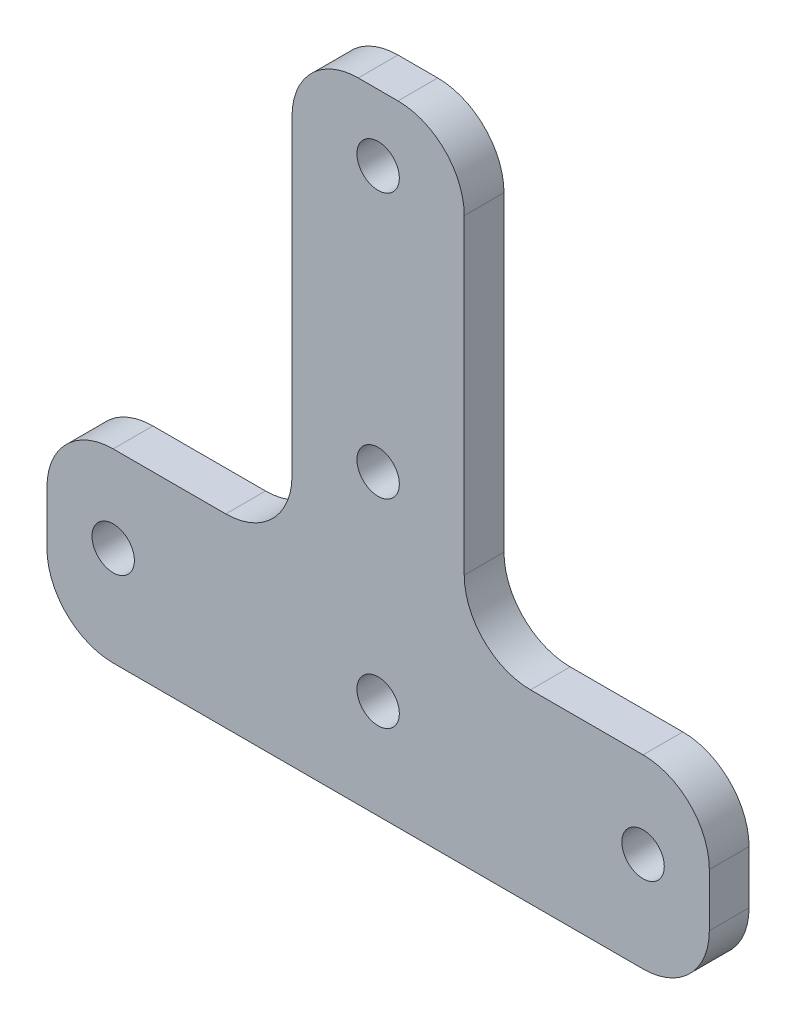
from build123d import *

# Parameters (mm, degrees)
SKETCH_1_R      = 1.6
EXTRUDE_1_DEPTH = 3
FILLET_1_R      = 5


with BuildPart() as part:
    # 草图1 → 凸台-拉伸1 (new body)
    with BuildSketch(Plane.XY):
        Polygon((-6.5, 6.5), (-25, 6.5), (-25, -7.5), (25, -7.5), (25, 6.5), (6.5, 6.5), (6.5, 40), (-6.5, 40), align=None)
        with Locations((0, 35)):
            Circle(SKETCH_1_R, mode=Mode.SUBTRACT)
        with Locations((0, 15)):
            Circle(SKETCH_1_R, mode=Mode.SUBTRACT)
        Circle(SKETCH_1_R, mode=Mode.SUBTRACT)
        with Locations((20, 0)):
            Circle(SKETCH_1_R, mode=Mode.SUBTRACT)
        with Locations((-20, 0)):
            Circle(SKETCH_1_R, mode=Mode.SUBTRACT)
    extrude(amount=EXTRUDE_1_DEPTH)

    # 圆角1
    fillet_1_edges = [part.edges().sort_by_distance(p)[0] for p in [
        (-6.5, 40, 1.5),
        (6.5, 40, 1.5),
        (6.5, 6.5, 1.5),
        (25, 6.5, 1.5),
        (25, -7.5, 1.5),
        (-25, -7.5, 1.5),
        (-25, 6.5, 1.5),
        (-6.5, 6.5, 1.5),
    ]]
    fillet(fillet_1_edges, radius=FILLET_1_R)


solid = part.part
